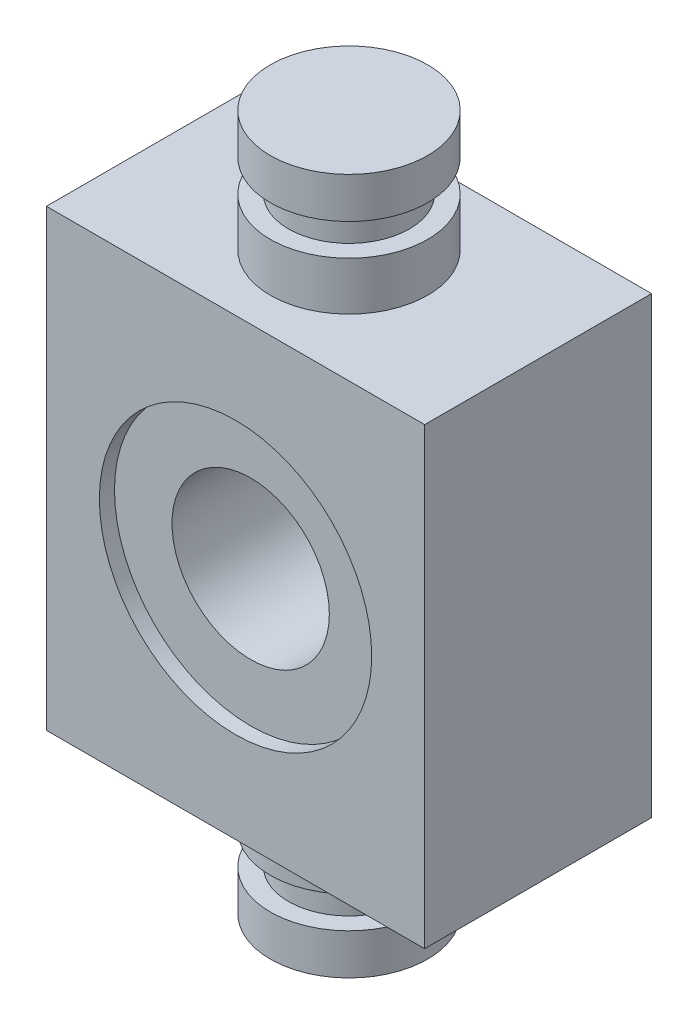
from build123d import *

# Parameters (mm, degrees)
SKETCH1_W               = 150
SKETCH1_H               = 125
BOSS_EXTRUDE1_DEPTH     = 37.5
CUT_EXTRUDE1_DEPTH      = 124.110722522
CUT_EXTRUDE1_DEPTH_BACK = 5
SKETCH2_R               = 45
CUT_EXTRUDE2_REACH      = 122.13
SKETCH3_R               = 26
SKETCH4_R               = 26
BOSS_EXTRUDE2_DEPTH     = 16
SKETCH5_R               = 20
BOSS_EXTRUDE3_DEPTH     = 10.5
SKETCH6_R               = 26
BOSS_EXTRUDE4_DEPTH     = 13.5


with BuildPart() as part:
    # Sketch1 → Boss-Extrude1 (new, symmetric)
    with BuildSketch(Plane(origin=(0, 0, 0), x_dir=(0, 1, 0), z_dir=(0, 0, 1))):
        Rectangle(SKETCH1_W, SKETCH1_H)
    extrude(amount=BOSS_EXTRUDE1_DEPTH, both=True)

    # Sketch2 → Cut-Extrude1 (cut, two sides: drawn at the far end of the back side and taken through both)
    with BuildSketch(Plane.XY.offset(37.5).offset(-CUT_EXTRUDE1_DEPTH_BACK)):
        with Locations(Location((0, 0, 0), (0, 0, 180))):
            Circle(SKETCH2_R)
    extrude(amount=CUT_EXTRUDE1_DEPTH + CUT_EXTRUDE1_DEPTH_BACK, mode=Mode.SUBTRACT)

    # Sketch3 → Cut-Extrude2 (cut, up to next)
    with BuildSketch(Plane.XY.offset(32.5), mode=Mode.PRIVATE) as cut_extrude2_sk1:
        Circle(SKETCH3_R)
    cut_extrude2_tool1 = extrude(cut_extrude2_sk1.sketch, amount=-CUT_EXTRUDE2_REACH, mode=Mode.PRIVATE) & part.part
    add(cut_extrude2_tool1.solids().sort_by_distance((0, 0, 32.5))[0], mode=Mode.SUBTRACT)

    # Sketch4 → Boss-Extrude2 (add)
    with BuildSketch(Plane(origin=(0, 75, 0), x_dir=(-1, 0, 0), z_dir=(0, 1, 0))):
        Circle(SKETCH4_R)
    boss_extrude2 = extrude(amount=BOSS_EXTRUDE2_DEPTH)

    # Sketch5 → Boss-Extrude3 (add)
    with BuildSketch(Plane(origin=(0, 91, 0), x_dir=(-1, 0, 0), z_dir=(0, 1, 0))):
        with Locations(Location((0, 0, 0), (0, 0, 180))):
            Circle(SKETCH5_R)
    boss_extrude3 = extrude(amount=BOSS_EXTRUDE3_DEPTH)

    # Sketch6 → Boss-Extrude4 (add)
    with BuildSketch(Plane(origin=(0, 101.5, 0), x_dir=(-1, 0, 0), z_dir=(0, 1, 0))):
        Circle(SKETCH6_R)
    boss_extrude4 = extrude(amount=BOSS_EXTRUDE4_DEPTH)

    # Mirror1: Boss-Extrude2, Boss-Extrude3, Boss-Extrude4 across plane
    add(boss_extrude2.mirror(Plane.ZX))
    add(boss_extrude3.mirror(Plane.ZX))
    add(boss_extrude4.mirror(Plane.ZX))


solid = part.part
